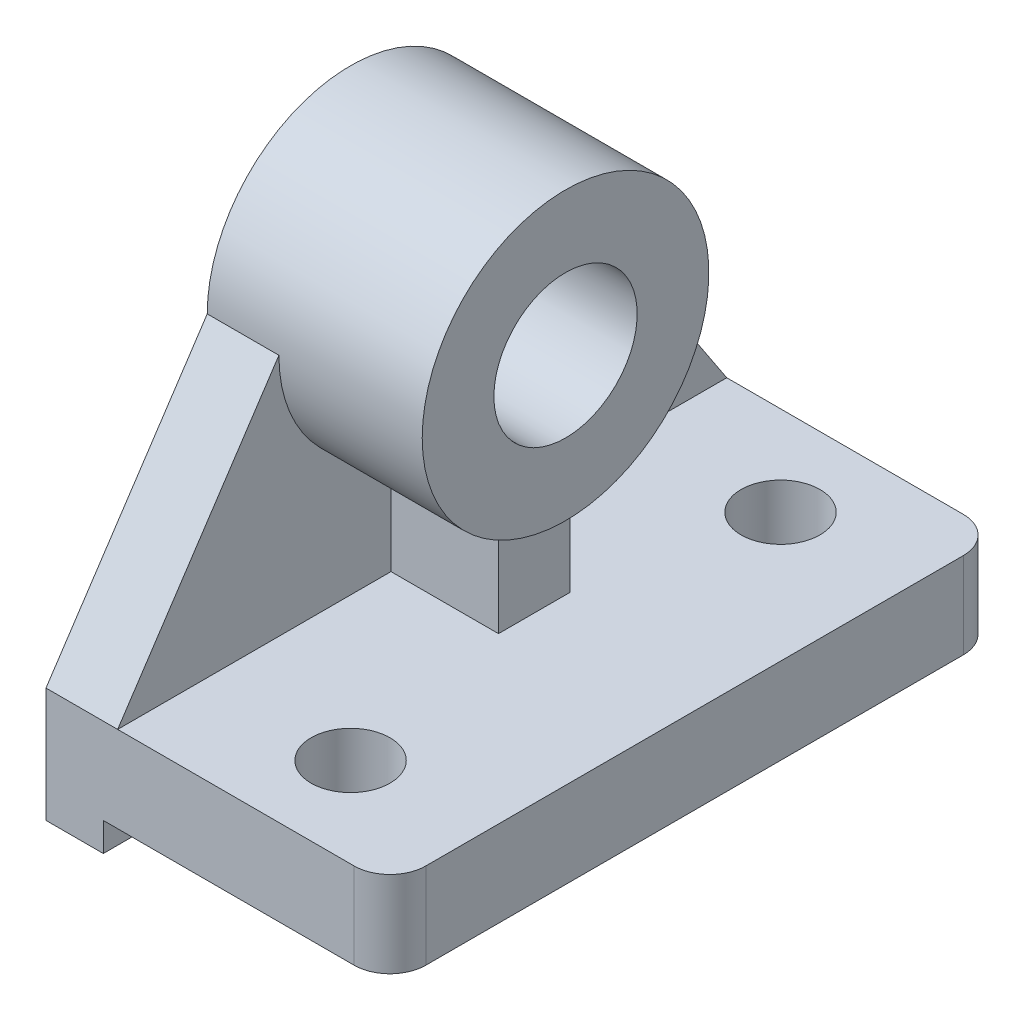
from build123d import *

# Parameters (mm, degrees)
BOSS_EXTRUDE1_DEPTH = 12
SKETCH3_R           = 20
SKETCH3_R_2         = 10
BOSS_EXTRUDE2_DEPTH = 30
BOSS_EXTRUDE3_DEPTH = 10
SKETCH5_R           = 5.5
CUT_EXTRUDE1_DEPTH  = 97.587759017
SKETCH6_W           = 8
SKETCH6_H           = 4
BOSS_EXTRUDE4_DEPTH = 85
SKETCH7_W           = 5
SKETCH7_H           = 20.431914742
BOSS_EXTRUDE5_DEPTH = 15


with BuildPart() as part:
    # Sketch2 → Boss-Extrude1 (new body)
    with BuildSketch(Plane(origin=(0, 0, 0), x_dir=(1, 0, 0), z_dir=(0, 1, 0))):
        with BuildLine():
            Line((-18.765432099, -74.580246914), (-18.765432099, 10.419753086))
            Line((-18.765432099, 10.419753086), (24.234567901, 10.419753086))
            ThreePointArc((24.234567901, 10.419753086), (27.770101807, 8.955286992), (29.234567901, 5.419753086))
            Line((29.234567901, 5.419753086), (29.234567901, -69.580246914))
            ThreePointArc((29.234567901, -69.580246914), (27.770101807, -73.11578082), (24.234567901, -74.580246914))
            Line((24.234567901, -74.580246914), (-18.765432099, -74.580246914))
        make_face()
    extrude(amount=-BOSS_EXTRUDE1_DEPTH)



with BuildPart() as body_2:
    # Sketch3 → Boss-Extrude2 (new body)
    with BuildSketch(Plane.ZY.offset(18.765432099)):
        with Locations((32.080246914, 33.965933716)):
            Circle(SKETCH3_R)
        with Locations((32.080246914, 33.965933716)):
            Circle(SKETCH3_R_2, mode=Mode.SUBTRACT)
    extrude(amount=-BOSS_EXTRUDE2_DEPTH)


with BuildPart() as part_1:
    add(part.part)

    add(body_2.part)  # Boss-Extrude3 merges body 2
    # Sketch4 → Boss-Extrude3 (add)
    with BuildSketch(Plane.ZY.offset(18.765432099)):
        with BuildLine():
            Line((12.080246914, 33.965933716), (-10.419753086, 0))
            Line((-10.419753086, 0), (74.580246914, 0))
            Line((74.580246914, 0), (52.080246914, 33.965933716))
            ThreePointArc((52.080246914, 33.965933716), (32.080246914, 13.965933716), (12.080246914, 33.965933716))
        make_face()
    extrude(amount=-BOSS_EXTRUDE3_DEPTH)

    # Sketch5 → Cut-Extrude1 (cut, through all)
    with BuildSketch(Plane(origin=(0, 0, 0), x_dir=(1, 0, 0), z_dir=(0, 1, 0))):
        with Locations(Location((11.234567901, -2.080246914, 0), (0, 0, 270))):
            Circle(SKETCH5_R)
        with Locations(Location((11.234567901, -62.080246914, 0), (0, 0, 270))):
            Circle(SKETCH5_R)
    extrude(amount=-CUT_EXTRUDE1_DEPTH, mode=Mode.SUBTRACT)

    # Sketch6 → Boss-Extrude4 (add)
    with BuildSketch(Plane.XY.offset(74.580246914)):
        with Locations((-14.765432099, -14)):
            Rectangle(SKETCH6_W, SKETCH6_H)
    extrude(amount=-BOSS_EXTRUDE4_DEPTH)

    # Sketch7 → Boss-Extrude5 (add)
    with BuildSketch(Plane.ZY.offset(8.765432099)):
        Polygon((36.436270076, 20.431914742), (31.436270076, 20.431914742), (31.436270076, 0), (36.436270076, 0), (36.436270076, 14.206805316), align=None)
        with Locations((28.936270076, 10.215957371)):
            Rectangle(SKETCH7_W, SKETCH7_H)
    extrude(amount=-BOSS_EXTRUDE5_DEPTH)


solid = part_1.part
